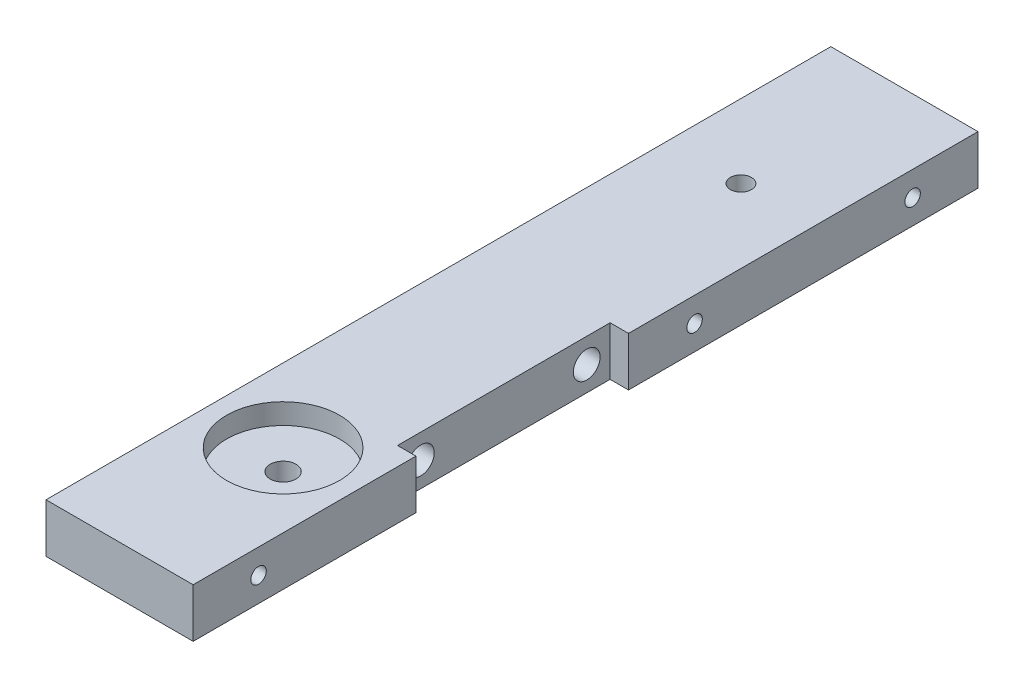
from build123d import *

# Parameters (mm, degrees)
SKETCH2_W             = 28.575
SKETCH2_H             = 152.4
BOSS_EXTRUDE1_DEPTH   = 9.525
F_3_0MM_DOWEL_HOLE1_D = 3
LPATTERN1_COUNT       = 4
LPATTERN1_PITCH       = 42.333333333
SKETCH12_R            = 2.05
CUT_EXTRUDE1_DEPTH    = 156.348048749
SKETCH12_4_R          = 10.975
CUT_EXTRUDE2_DEPTH    = 4
SKETCH15_R            = 2.5
CUT_EXTRUDE3_DEPTH    = 156.154169296
SKETCH13_R            = 2.6
CUT_EXTRUDE4_DEPTH    = 156.348048749
SKETCH17_W            = 41.28
SKETCH17_H            = 9.525
CUT_EXTRUDE5_DEPTH    = 3.575


with BuildPart() as part:
    # Sketch2 → Boss-Extrude1 (new body)
    with BuildSketch(Plane(origin=(0, 0, 0), x_dir=(1, 0, 0), z_dir=(0, 1, 0))):
        with Locations((14.2875, 76.2)):
            Rectangle(SKETCH2_W, SKETCH2_H)
    extrude(amount=BOSS_EXTRUDE1_DEPTH)

    # Ø3.0mm Dowel Hole1 (through all)
    with Locations(Plane.ZY):
        with Locations((-139.7, 4.7625)):
            f_3_0mm_dowel_hole1 = Hole(F_3_0MM_DOWEL_HOLE1_D / 2)

    # LPattern1: Ø3.0mm Dowel Hole1 ×4, 1 skipped
    with Locations(*[(0, 0, i * LPATTERN1_PITCH) for i in range(1, LPATTERN1_COUNT) if i not in (2,)]):
        add(f_3_0mm_dowel_hole1, mode=Mode.SUBTRACT)

    # Sketch12 → Cut-Extrude1 (cut, through all)
    with BuildSketch(Plane(origin=(0, 9.525, 0), x_dir=(1, 0, 0), z_dir=(0, 1, 0))):
        with Locations(Location((14.2875, 120.65, 0), (0, 0, 270))):
            Circle(SKETCH12_R)
    extrude(amount=-CUT_EXTRUDE1_DEPTH, mode=Mode.SUBTRACT)

    # Sketch12<4> → Cut-Extrude2 (cut)
    with BuildSketch(Plane(origin=(0, 9.525, 0), x_dir=(1, 0, 0), z_dir=(0, 1, 0))):
        with Locations(Location((14.2875, 31.75, 0), (0, 0, 270))):
            Circle(SKETCH12_4_R)
    extrude(amount=-CUT_EXTRUDE2_DEPTH, mode=Mode.SUBTRACT)

    # Sketch15 → Cut-Extrude3 (cut, through all)
    with BuildSketch(Plane(origin=(0, 5.525, 0), x_dir=(1, 0, 0), z_dir=(0, 1, 0))):
        with Locations(Location((14.2875, 31.75, 0), (0, 0, 270))):
            Circle(SKETCH15_R)
    extrude(amount=-CUT_EXTRUDE3_DEPTH, mode=Mode.SUBTRACT)

    # Sketch13 → Cut-Extrude4 (cut, through all)
    with BuildSketch(Plane.ZY):
        with Locations((-80, 4.7625)):
            Circle(SKETCH13_R)
        with Locations((-47.79, 4.7625)):
            Circle(SKETCH13_R)
    extrude(amount=-CUT_EXTRUDE4_DEPTH, mode=Mode.SUBTRACT)

    # Sketch17 → Cut-Extrude5 (cut)
    with BuildSketch(Plane.ZY.offset(-28.575)):
        with Locations((-63.895, 4.7625)):
            Rectangle(SKETCH17_W, SKETCH17_H)
    extrude(amount=CUT_EXTRUDE5_DEPTH, mode=Mode.SUBTRACT)


solid = part.part
